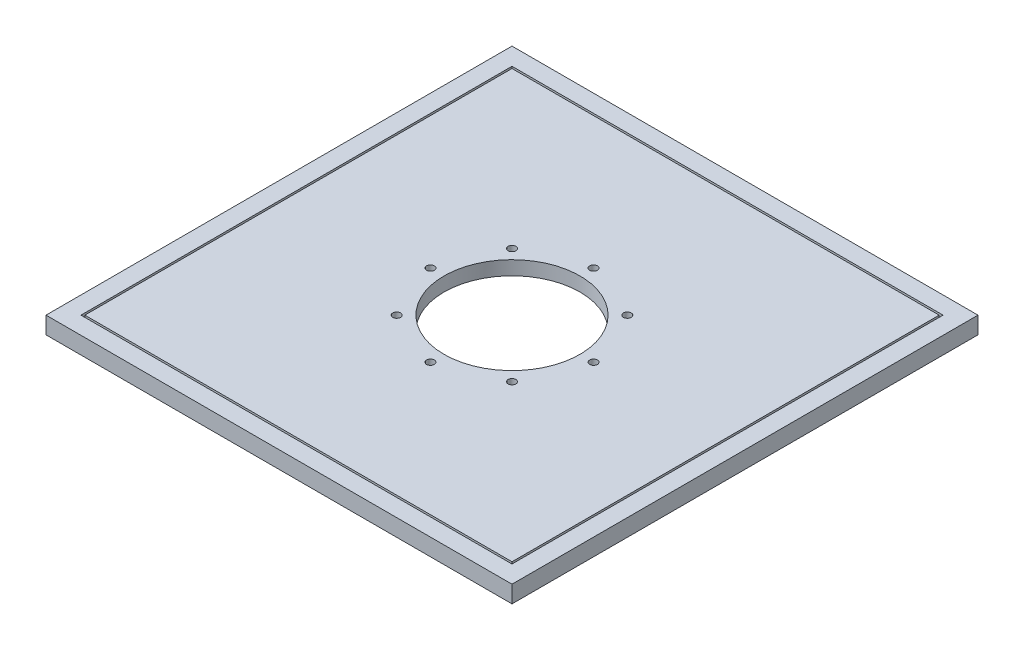
from build123d import *

# Parameters (mm, degrees)
SKETCH1_W          = 600
SKETCH1_H          = 600
PLATE_DEPTH        = 22
SKETCH2_R          = 87.5
BEARING_HOLE_DEPTH = 425.834085262
SKETCH4_W          = 555
SKETCH4_H          = 555
SKETCH4_W_2        = 550
SKETCH4_H_2        = 550
CUT_EXTRUDE3_DEPTH = 10
SKETCH5_R          = 125
CUT_EXTRUDE4_DEPTH = 4
SKETCH6_R          = 5
CUT_EXTRUDE5_DEPTH = 425.645734701


with BuildPart() as part:
    # Sketch1 → plate (new body)
    with BuildSketch(Plane(origin=(0, 0, 0), x_dir=(1, 0, 0), z_dir=(0, 1, 0))):
        Rectangle(SKETCH1_W, SKETCH1_H)
    extrude(amount=PLATE_DEPTH)

    # Sketch2 → bearing-hole (cut, through all)
    with BuildSketch(Plane(origin=(0, 22, 0), x_dir=(1, 0, 0), z_dir=(0, 1, 0))):
        with Locations(Location((0, 0, 0), (0, 0, 270))):
            Circle(SKETCH2_R)
    extrude(amount=-BEARING_HOLE_DEPTH, mode=Mode.SUBTRACT)

    # Sketch4 → Cut-Extrude3 (cut)
    with BuildSketch(Plane(origin=(0, 22, 0), x_dir=(1, 0, 0), z_dir=(0, 1, 0))):
        Rectangle(SKETCH4_W, SKETCH4_H)
        Rectangle(SKETCH4_W_2, SKETCH4_H_2, mode=Mode.SUBTRACT)
    extrude(amount=-CUT_EXTRUDE3_DEPTH, mode=Mode.SUBTRACT)

    # Sketch5 → Cut-Extrude4 (cut)
    with BuildSketch(Plane.XZ):
        with Locations(Location((0, 0, 0), (0, 0, 270))):
            Circle(SKETCH5_R)
    extrude(amount=-CUT_EXTRUDE4_DEPTH, mode=Mode.SUBTRACT)

    # Sketch6 → Cut-Extrude5 (cut, through all)
    with BuildSketch(Plane.XZ.offset(-4)):
        with Locations(Location((0, 105, 0), (0, 0, 270))):
            Circle(SKETCH6_R)
        with Locations(Location((74.246212025, 74.246212025, 0), (0, 0, 270))):
            Circle(SKETCH6_R)
        with Locations(Location((105, 0, 0), (0, 0, 270))):
            Circle(SKETCH6_R)
        with Locations(Location((74.246212025, -74.246212025, 0), (0, 0, 270))):
            Circle(SKETCH6_R)
        with Locations(Location((0, -105, 0), (0, 0, 270))):
            Circle(SKETCH6_R)
        with Locations(Location((-74.246212025, -74.246212025, 0), (0, 0, 270))):
            Circle(SKETCH6_R)
        with Locations(Location((-105, 0, 0), (0, 0, 270))):
            Circle(SKETCH6_R)
        with Locations(Location((-74.246212025, 74.246212025, 0), (0, 0, 270))):
            Circle(SKETCH6_R)
    extrude(amount=-CUT_EXTRUDE5_DEPTH, mode=Mode.SUBTRACT)


solid = part.part
